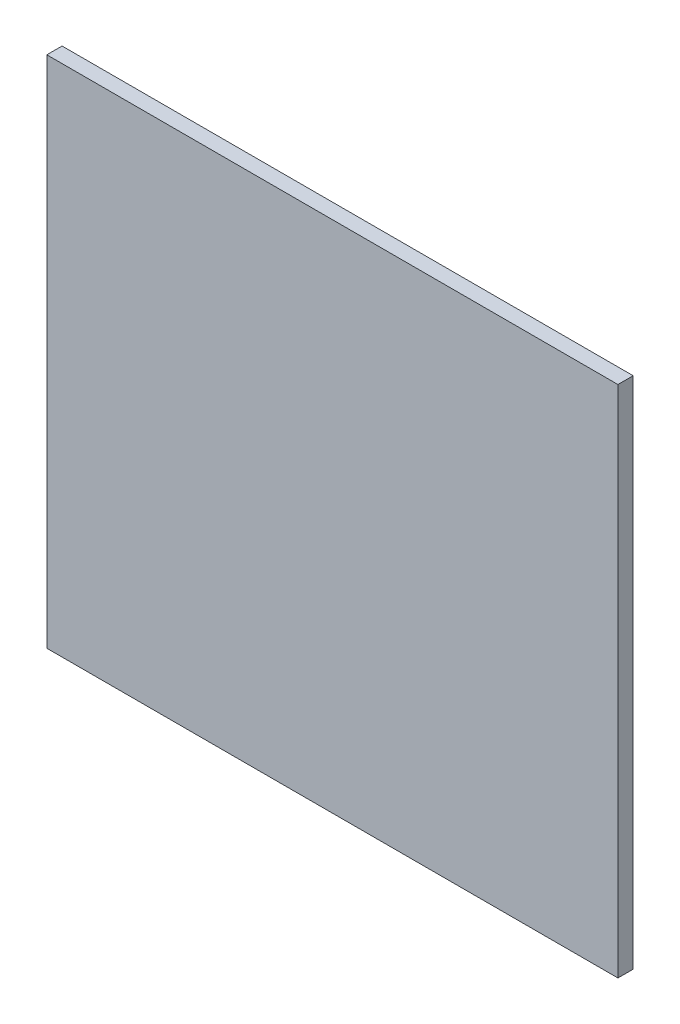
from build123d import *

# Parameters (mm, degrees)
SKETCH_1_W      = 300
SKETCH_1_H      = 270
EXTRUDE_1_DEPTH = 8


with BuildPart() as part:
    # Эскиз1 → Бобышка-Вытянуть1 (new body)
    with BuildSketch(Plane.XY):
        with Locations((150, 135)):
            Rectangle(SKETCH_1_W, SKETCH_1_H)
    extrude(amount=EXTRUDE_1_DEPTH)


solid = part.part
